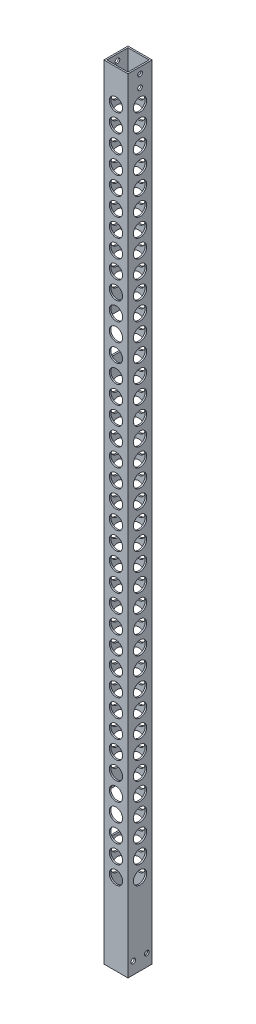
from build123d import *

# Parameters (mm, degrees)
SKETCH1_W                    = 25.4
SKETCH1_H                    = 25.4
SKETCH1_W_2                  = 22.225
SKETCH1_H_2                  = 22.225
BOSS_EXTRUDE1_DEPTH          = 412.3055
CUT_EXTRUDE1_DEPTH           = 413.69650511
CUT_EXTRUDE1_DEPTH_BACK      = 413.69650511
SKETCH2_R                    = 2.4765
CUT_EXTRUDE2_DEPTH           = 413.69650511
CUT_EXTRUDE2_DEPTH_BACK      = 413.69650511
SKETCH3_R                    = 2.4765
CUT_EXTRUDE3_REACH           = 415.282
SKETCH4_W                    = 15.24
SKETCH4_H                    = 15.24
FILLET1_R                    = 2.54
CUT_EXTRUDE4_DEPTH           = 413.69650511
CUT_EXTRUDE4_DEPTH_BACK      = 413.69650511
SKETCH5_R                    = 2.4892
SKETCH6_R                    = 6.985
CUT_EXTRUDE5_DEPTH           = 2.54
LPATTERN1_COUNT              = 38
LPATTERN1_PITCH              = 19.05
CIRPATTERN1_COUNT            = 4
CIRPATTERN1_COPY_1_SKETCH_R  = 6.985
CIRPATTERN1_COPY_1_DEPTH     = 2.54
CIRPATTERN1_COPY_2_SKETCH_R  = 6.985
CIRPATTERN1_COPY_2_DEPTH     = 2.54
CIRPATTERN1_COPY_3_SKETCH_R  = 6.985
CIRPATTERN1_COPY_3_DEPTH     = 2.54
CIRPATTERN1_COPY_4_SKETCH_R  = 6.985
CIRPATTERN1_COPY_4_DEPTH     = 2.54
CIRPATTERN1_COPY_5_SKETCH_R  = 6.985
CIRPATTERN1_COPY_5_DEPTH     = 2.54
CIRPATTERN1_COPY_6_SKETCH_R  = 6.985
CIRPATTERN1_COPY_6_DEPTH     = 2.54
CIRPATTERN1_COPY_7_SKETCH_R  = 6.985
CIRPATTERN1_COPY_7_DEPTH     = 2.54
CIRPATTERN1_COPY_8_SKETCH_R  = 6.985
CIRPATTERN1_COPY_8_DEPTH     = 2.54
CIRPATTERN1_COPY_9_SKETCH_R  = 6.985
CIRPATTERN1_COPY_9_DEPTH     = 2.54
CIRPATTERN1_COPY_10_SKETCH_R = 6.985
CIRPATTERN1_COPY_10_DEPTH    = 2.54
CIRPATTERN1_COPY_11_SKETCH_R = 6.985
CIRPATTERN1_COPY_11_DEPTH    = 2.54
CIRPATTERN1_COPY_12_SKETCH_R = 6.985
CIRPATTERN1_COPY_12_DEPTH    = 2.54
CIRPATTERN1_COPY_13_SKETCH_R = 6.985
CIRPATTERN1_COPY_13_DEPTH    = 2.54
CIRPATTERN1_COPY_14_SKETCH_R = 6.985
CIRPATTERN1_COPY_14_DEPTH    = 2.54
CIRPATTERN1_COPY_15_SKETCH_R = 6.985
CIRPATTERN1_COPY_15_DEPTH    = 2.54
CIRPATTERN1_COPY_16_SKETCH_R = 6.985
CIRPATTERN1_COPY_16_DEPTH    = 2.54
CIRPATTERN1_COPY_17_SKETCH_R = 6.985
CIRPATTERN1_COPY_17_DEPTH    = 2.54
CIRPATTERN1_COPY_18_SKETCH_R = 6.985
CIRPATTERN1_COPY_18_DEPTH    = 2.54
CIRPATTERN1_COPY_19_SKETCH_R = 6.985
CIRPATTERN1_COPY_19_DEPTH    = 2.54
CIRPATTERN1_COPY_20_SKETCH_R = 6.985
CIRPATTERN1_COPY_20_DEPTH    = 2.54
CIRPATTERN1_COPY_21_SKETCH_R = 6.985
CIRPATTERN1_COPY_21_DEPTH    = 2.54
CIRPATTERN1_COPY_22_SKETCH_R = 6.985
CIRPATTERN1_COPY_22_DEPTH    = 2.54
CIRPATTERN1_COPY_23_SKETCH_R = 6.985
CIRPATTERN1_COPY_23_DEPTH    = 2.54
CIRPATTERN1_COPY_24_SKETCH_R = 6.985
CIRPATTERN1_COPY_24_DEPTH    = 2.54
CIRPATTERN1_COPY_25_SKETCH_R = 6.985
CIRPATTERN1_COPY_25_DEPTH    = 2.54
CIRPATTERN1_COPY_26_SKETCH_R = 6.985
CIRPATTERN1_COPY_26_DEPTH    = 2.54
CIRPATTERN1_COPY_27_SKETCH_R = 6.985
CIRPATTERN1_COPY_27_DEPTH    = 2.54
CIRPATTERN1_COPY_28_SKETCH_R = 6.985
CIRPATTERN1_COPY_28_DEPTH    = 2.54
CIRPATTERN1_COPY_29_SKETCH_R = 6.985
CIRPATTERN1_COPY_29_DEPTH    = 2.54
CIRPATTERN1_COPY_30_SKETCH_R = 6.985
CIRPATTERN1_COPY_30_DEPTH    = 2.54
CIRPATTERN1_COPY_31_SKETCH_R = 6.985
CIRPATTERN1_COPY_31_DEPTH    = 2.54
CIRPATTERN1_COPY_32_SKETCH_R = 6.985
CIRPATTERN1_COPY_32_DEPTH    = 2.54
CIRPATTERN1_COPY_33_SKETCH_R = 6.985
CIRPATTERN1_COPY_33_DEPTH    = 2.54
CIRPATTERN1_COPY_34_SKETCH_R = 6.985
CIRPATTERN1_COPY_34_DEPTH    = 2.54
CIRPATTERN1_COPY_35_SKETCH_R = 6.985
CIRPATTERN1_COPY_35_DEPTH    = 2.54
CIRPATTERN1_COPY_36_SKETCH_R = 6.985
CIRPATTERN1_COPY_36_DEPTH    = 2.54
CIRPATTERN1_COPY_37_SKETCH_R = 6.985
CIRPATTERN1_COPY_37_DEPTH    = 2.54
CIRPATTERN1_COPY_38_SKETCH_R = 6.985
CIRPATTERN1_COPY_38_DEPTH    = 2.54
CIRPATTERN1_COPY_39_SKETCH_R = 6.985
CIRPATTERN1_COPY_39_DEPTH    = 2.54
CIRPATTERN1_COPY_40_SKETCH_R = 6.985
CIRPATTERN1_COPY_40_DEPTH    = 2.54
CIRPATTERN1_COPY_41_SKETCH_R = 6.985
CIRPATTERN1_COPY_41_DEPTH    = 2.54
CIRPATTERN1_COPY_42_SKETCH_R = 6.985
CIRPATTERN1_COPY_42_DEPTH    = 2.54
CIRPATTERN1_COPY_43_SKETCH_R = 6.985
CIRPATTERN1_COPY_43_DEPTH    = 2.54
CIRPATTERN1_COPY_44_SKETCH_R = 6.985
CIRPATTERN1_COPY_44_DEPTH    = 2.54
CIRPATTERN1_COPY_45_SKETCH_R = 6.985
CIRPATTERN1_COPY_45_DEPTH    = 2.54
CIRPATTERN1_COPY_46_SKETCH_R = 6.985
CIRPATTERN1_COPY_46_DEPTH    = 2.54
CIRPATTERN1_COPY_47_SKETCH_R = 6.985
CIRPATTERN1_COPY_47_DEPTH    = 2.54
CIRPATTERN1_COPY_48_SKETCH_R = 6.985
CIRPATTERN1_COPY_48_DEPTH    = 2.54
CIRPATTERN1_COPY_49_SKETCH_R = 6.985
CIRPATTERN1_COPY_49_DEPTH    = 2.54
CIRPATTERN1_COPY_50_SKETCH_R = 6.985
CIRPATTERN1_COPY_50_DEPTH    = 2.54
CIRPATTERN1_COPY_51_SKETCH_R = 6.985
CIRPATTERN1_COPY_51_DEPTH    = 2.54
CIRPATTERN1_COPY_52_SKETCH_R = 6.985
CIRPATTERN1_COPY_52_DEPTH    = 2.54
CIRPATTERN1_COPY_53_SKETCH_R = 6.985
CIRPATTERN1_COPY_53_DEPTH    = 2.54
CIRPATTERN1_COPY_54_SKETCH_R = 6.985
CIRPATTERN1_COPY_54_DEPTH    = 2.54
CIRPATTERN1_COPY_55_SKETCH_R = 6.985
CIRPATTERN1_COPY_55_DEPTH    = 2.54
CIRPATTERN1_COPY_56_SKETCH_R = 6.985
CIRPATTERN1_COPY_56_DEPTH    = 2.54
CIRPATTERN1_COPY_57_SKETCH_R = 6.985
CIRPATTERN1_COPY_57_DEPTH    = 2.54
CIRPATTERN1_COPY_58_SKETCH_R = 6.985
CIRPATTERN1_COPY_58_DEPTH    = 2.54
CIRPATTERN1_COPY_59_SKETCH_R = 6.985
CIRPATTERN1_COPY_59_DEPTH    = 2.54
CIRPATTERN1_COPY_60_SKETCH_R = 6.985
CIRPATTERN1_COPY_60_DEPTH    = 2.54
CIRPATTERN1_COPY_61_SKETCH_R = 6.985
CIRPATTERN1_COPY_61_DEPTH    = 2.54
CIRPATTERN1_COPY_62_SKETCH_R = 6.985
CIRPATTERN1_COPY_62_DEPTH    = 2.54
CIRPATTERN1_COPY_63_SKETCH_R = 6.985
CIRPATTERN1_COPY_63_DEPTH    = 2.54
CIRPATTERN1_COPY_64_SKETCH_R = 6.985
CIRPATTERN1_COPY_64_DEPTH    = 2.54
CIRPATTERN1_COPY_65_SKETCH_R = 6.985
CIRPATTERN1_COPY_65_DEPTH    = 2.54
CIRPATTERN1_COPY_66_SKETCH_R = 6.985
CIRPATTERN1_COPY_66_DEPTH    = 2.54
CIRPATTERN1_COPY_67_SKETCH_R = 6.985
CIRPATTERN1_COPY_67_DEPTH    = 2.54
CIRPATTERN1_COPY_68_SKETCH_R = 6.985
CIRPATTERN1_COPY_68_DEPTH    = 2.54
CIRPATTERN1_COPY_69_SKETCH_R = 6.985
CIRPATTERN1_COPY_69_DEPTH    = 2.54
CIRPATTERN1_COPY_70_SKETCH_R = 6.985
CIRPATTERN1_COPY_70_DEPTH    = 2.54
CIRPATTERN1_COPY_71_SKETCH_R = 6.985
CIRPATTERN1_COPY_71_DEPTH    = 2.54
CIRPATTERN1_COPY_72_SKETCH_R = 6.985
CIRPATTERN1_COPY_72_DEPTH    = 2.54
CIRPATTERN1_COPY_73_SKETCH_R = 6.985
CIRPATTERN1_COPY_73_DEPTH    = 2.54
CIRPATTERN1_COPY_74_SKETCH_R = 6.985
CIRPATTERN1_COPY_74_DEPTH    = 2.54
SKETCH7_W                    = 19.05
SKETCH7_H                    = 38.1
CUT_EXTRUDE6_DEPTH           = 2.54
CUT_EXTRUDE7_START           = -2.54
SKETCH8_R                    = 6.985
CUT_EXTRUDE7_DEPTH           = 2.54
LPATTERN2_COUNT              = 38
LPATTERN2_PITCH              = 19.05


with BuildPart() as part:
    # Sketch1 → Boss-Extrude1 (new, symmetric)
    with BuildSketch(Plane(origin=(0, 0, 0), x_dir=(1, 0, 0), z_dir=(0, 1, 0))):
        Rectangle(SKETCH1_W, SKETCH1_H)
        Rectangle(SKETCH1_W_2, SKETCH1_H_2, mode=Mode.SUBTRACT)
    extrude(amount=BOSS_EXTRUDE1_DEPTH, both=True)

    # Sketch2 → Cut-Extrude1 (cut, two sides: drawn at the far end of the back side and taken through both)
    with BuildSketch(Plane(origin=(0, 0, 0), x_dir=(0, 0, -1), z_dir=(1, 0, 0)).offset(-CUT_EXTRUDE1_DEPTH_BACK)):
        with Locations((-7.14375, -399.6055)):
            Circle(SKETCH2_R)
        with Locations((7.14375, -399.6055)):
            Circle(SKETCH2_R)
    extrude(amount=CUT_EXTRUDE1_DEPTH + CUT_EXTRUDE1_DEPTH_BACK, mode=Mode.SUBTRACT)

    # Sketch3 → Cut-Extrude2 (cut, two sides: drawn at the far end of the back side and taken through both)
    with BuildSketch(Plane(origin=(0, 0, 0), x_dir=(0, 0, -1), z_dir=(1, 0, 0)).offset(-CUT_EXTRUDE2_DEPTH_BACK)):
        with Locations((0, 405.9555)):
            Circle(SKETCH3_R)
        with Locations((0, 393.2555)):
            Circle(SKETCH3_R)
    extrude(amount=CUT_EXTRUDE2_DEPTH + CUT_EXTRUDE2_DEPTH_BACK, mode=Mode.SUBTRACT)

    # Sketch4 → Cut-Extrude3 (cut, up to next)
    with BuildSketch(Plane.ZY.offset(12.7), mode=Mode.PRIVATE) as cut_extrude3_sk1:
        with Locations((0, -290.5125)):
            Rectangle(SKETCH4_W, SKETCH4_H)
    cut_extrude3_tool1 = extrude(cut_extrude3_sk1.sketch, amount=-CUT_EXTRUDE3_REACH, mode=Mode.PRIVATE) & part.part
    add(cut_extrude3_tool1.solids().sort_by_distance((-12.7, -290.5125, 0))[0], mode=Mode.SUBTRACT)

    # Fillet1
    fillet1_edges = [part.edges().sort_by_distance(p)[0] for p in [
        (-11.90625, -282.8925, -7.62),
        (-11.90625, -298.1325, -7.62),
        (-11.90625, -298.1325, 7.62),
        (-11.90625, -282.8925, 7.62),
    ]]
    fillet(fillet1_edges, radius=FILLET1_R)

    # Sketch5 → Cut-Extrude4 (cut, two sides: drawn at the far end of the back side and taken through both)
    with BuildSketch(Plane.XY.offset(-CUT_EXTRUDE4_DEPTH_BACK)):
        with Locations((0, 380.5555)):
            Circle(SKETCH5_R)
        with Locations((0, 361.5055)):
            Circle(SKETCH5_R)
        with Locations((0, 342.4555)):
            Circle(SKETCH5_R)
        with Locations((0, 323.4055)):
            Circle(SKETCH5_R)
        with Locations((0, 304.3555)):
            Circle(SKETCH5_R)
        with Locations((0, 285.3055)):
            Circle(SKETCH5_R)
        with Locations((0, 266.2555)):
            Circle(SKETCH5_R)
        with Locations((0, 247.2055)):
            Circle(SKETCH5_R)
        with Locations((0, 228.1555)):
            Circle(SKETCH5_R)
        with Locations((0, 209.1055)):
            Circle(SKETCH5_R)
        with Locations((0, 190.0555)):
            Circle(SKETCH5_R)
        with Locations((0, 171.0055)):
            Circle(SKETCH5_R)
        with Locations((0, 151.9555)):
            Circle(SKETCH5_R)
        with Locations((0, 132.9055)):
            Circle(SKETCH5_R)
        with Locations((0, 113.8555)):
            Circle(SKETCH5_R)
    extrude(amount=CUT_EXTRUDE4_DEPTH + CUT_EXTRUDE4_DEPTH_BACK, mode=Mode.SUBTRACT)

    # Sketch6 → Cut-Extrude5 (cut)
    with BuildSketch(Plane.XY.offset(12.7)):
        with Locations((0, 378.0155)):
            Circle(SKETCH6_R)
    cut_extrude5 = extrude(amount=-CUT_EXTRUDE5_DEPTH, mode=Mode.SUBTRACT)

    # LPattern1: Cut-Extrude5 ×38
    with Locations(*[(0, -i * LPATTERN1_PITCH, 0) for i in range(1, LPATTERN1_COUNT)]):
        add(cut_extrude5, mode=Mode.SUBTRACT)

    # CirPattern1: Cut-Extrude5 ×4 about axis, 1 skipped
    cirpattern1_axis = Axis((0, -453.53605, 0), (0, 1, 0))
    add([cut_extrude5.rotate(cirpattern1_axis, i * 360 / CIRPATTERN1_COUNT) for i in range(1, CIRPATTERN1_COUNT) if i not in (3,)], mode=Mode.SUBTRACT)

    # CirPattern1 copy 1 sketch → CirPattern1 copy 1 (cut)
    with BuildSketch(Plane(origin=(12.7, -19.05, 0), x_dir=(0, 0, -1), z_dir=(1, 0, 0))):
        with Locations((0, 378.0155)):
            Circle(CIRPATTERN1_COPY_1_SKETCH_R)
    extrude(amount=-CIRPATTERN1_COPY_1_DEPTH, mode=Mode.SUBTRACT)

    # CirPattern1 copy 2 sketch → CirPattern1 copy 2 (cut)
    with BuildSketch(Plane(origin=(0, -19.05, -12.7), x_dir=(-1, 0, 0), z_dir=(0, 0, -1))):
        with Locations((0, 378.0155)):
            Circle(CIRPATTERN1_COPY_2_SKETCH_R)
    extrude(amount=-CIRPATTERN1_COPY_2_DEPTH, mode=Mode.SUBTRACT)

    # CirPattern1 copy 3 sketch → CirPattern1 copy 3 (cut)
    with BuildSketch(Plane(origin=(12.7, -38.1, 0), x_dir=(0, 0, -1), z_dir=(1, 0, 0))):
        with Locations((0, 378.0155)):
            Circle(CIRPATTERN1_COPY_3_SKETCH_R)
    extrude(amount=-CIRPATTERN1_COPY_3_DEPTH, mode=Mode.SUBTRACT)

    # CirPattern1 copy 4 sketch → CirPattern1 copy 4 (cut)
    with BuildSketch(Plane(origin=(0, -38.1, -12.7), x_dir=(-1, 0, 0), z_dir=(0, 0, -1))):
        with Locations((0, 378.0155)):
            Circle(CIRPATTERN1_COPY_4_SKETCH_R)
    extrude(amount=-CIRPATTERN1_COPY_4_DEPTH, mode=Mode.SUBTRACT)

    # CirPattern1 copy 5 sketch → CirPattern1 copy 5 (cut)
    with BuildSketch(Plane(origin=(12.7, -57.15, 0), x_dir=(0, 0, -1), z_dir=(1, 0, 0))):
        with Locations((0, 378.0155)):
            Circle(CIRPATTERN1_COPY_5_SKETCH_R)
    extrude(amount=-CIRPATTERN1_COPY_5_DEPTH, mode=Mode.SUBTRACT)

    # CirPattern1 copy 6 sketch → CirPattern1 copy 6 (cut)
    with BuildSketch(Plane(origin=(0, -57.15, -12.7), x_dir=(-1, 0, 0), z_dir=(0, 0, -1))):
        with Locations((0, 378.0155)):
            Circle(CIRPATTERN1_COPY_6_SKETCH_R)
    extrude(amount=-CIRPATTERN1_COPY_6_DEPTH, mode=Mode.SUBTRACT)

    # CirPattern1 copy 7 sketch → CirPattern1 copy 7 (cut)
    with BuildSketch(Plane(origin=(12.7, -76.2, 0), x_dir=(0, 0, -1), z_dir=(1, 0, 0))):
        with Locations((0, 378.0155)):
            Circle(CIRPATTERN1_COPY_7_SKETCH_R)
    extrude(amount=-CIRPATTERN1_COPY_7_DEPTH, mode=Mode.SUBTRACT)

    # CirPattern1 copy 8 sketch → CirPattern1 copy 8 (cut)
    with BuildSketch(Plane(origin=(0, -76.2, -12.7), x_dir=(-1, 0, 0), z_dir=(0, 0, -1))):
        with Locations((0, 378.0155)):
            Circle(CIRPATTERN1_COPY_8_SKETCH_R)
    extrude(amount=-CIRPATTERN1_COPY_8_DEPTH, mode=Mode.SUBTRACT)

    # CirPattern1 copy 9 sketch → CirPattern1 copy 9 (cut)
    with BuildSketch(Plane(origin=(12.7, -95.25, 0), x_dir=(0, 0, -1), z_dir=(1, 0, 0))):
        with Locations((0, 378.0155)):
            Circle(CIRPATTERN1_COPY_9_SKETCH_R)
    extrude(amount=-CIRPATTERN1_COPY_9_DEPTH, mode=Mode.SUBTRACT)

    # CirPattern1 copy 10 sketch → CirPattern1 copy 10 (cut)
    with BuildSketch(Plane(origin=(0, -95.25, -12.7), x_dir=(-1, 0, 0), z_dir=(0, 0, -1))):
        with Locations((0, 378.0155)):
            Circle(CIRPATTERN1_COPY_10_SKETCH_R)
    extrude(amount=-CIRPATTERN1_COPY_10_DEPTH, mode=Mode.SUBTRACT)

    # CirPattern1 copy 11 sketch → CirPattern1 copy 11 (cut)
    with BuildSketch(Plane(origin=(12.7, -114.3, 0), x_dir=(0, 0, -1), z_dir=(1, 0, 0))):
        with Locations((0, 378.0155)):
            Circle(CIRPATTERN1_COPY_11_SKETCH_R)
    extrude(amount=-CIRPATTERN1_COPY_11_DEPTH, mode=Mode.SUBTRACT)

    # CirPattern1 copy 12 sketch → CirPattern1 copy 12 (cut)
    with BuildSketch(Plane(origin=(0, -114.3, -12.7), x_dir=(-1, 0, 0), z_dir=(0, 0, -1))):
        with Locations((0, 378.0155)):
            Circle(CIRPATTERN1_COPY_12_SKETCH_R)
    extrude(amount=-CIRPATTERN1_COPY_12_DEPTH, mode=Mode.SUBTRACT)

    # CirPattern1 copy 13 sketch → CirPattern1 copy 13 (cut)
    with BuildSketch(Plane(origin=(12.7, -133.35, 0), x_dir=(0, 0, -1), z_dir=(1, 0, 0))):
        with Locations((0, 378.0155)):
            Circle(CIRPATTERN1_COPY_13_SKETCH_R)
    extrude(amount=-CIRPATTERN1_COPY_13_DEPTH, mode=Mode.SUBTRACT)

    # CirPattern1 copy 14 sketch → CirPattern1 copy 14 (cut)
    with BuildSketch(Plane(origin=(0, -133.35, -12.7), x_dir=(-1, 0, 0), z_dir=(0, 0, -1))):
        with Locations((0, 378.0155)):
            Circle(CIRPATTERN1_COPY_14_SKETCH_R)
    extrude(amount=-CIRPATTERN1_COPY_14_DEPTH, mode=Mode.SUBTRACT)

    # CirPattern1 copy 15 sketch → CirPattern1 copy 15 (cut)
    with BuildSketch(Plane(origin=(12.7, -152.4, 0), x_dir=(0, 0, -1), z_dir=(1, 0, 0))):
        with Locations((0, 378.0155)):
            Circle(CIRPATTERN1_COPY_15_SKETCH_R)
    extrude(amount=-CIRPATTERN1_COPY_15_DEPTH, mode=Mode.SUBTRACT)

    # CirPattern1 copy 16 sketch → CirPattern1 copy 16 (cut)
    with BuildSketch(Plane(origin=(0, -152.4, -12.7), x_dir=(-1, 0, 0), z_dir=(0, 0, -1))):
        with Locations((0, 378.0155)):
            Circle(CIRPATTERN1_COPY_16_SKETCH_R)
    extrude(amount=-CIRPATTERN1_COPY_16_DEPTH, mode=Mode.SUBTRACT)

    # CirPattern1 copy 17 sketch → CirPattern1 copy 17 (cut)
    with BuildSketch(Plane(origin=(12.7, -171.45, 0), x_dir=(0, 0, -1), z_dir=(1, 0, 0))):
        with Locations((0, 378.0155)):
            Circle(CIRPATTERN1_COPY_17_SKETCH_R)
    extrude(amount=-CIRPATTERN1_COPY_17_DEPTH, mode=Mode.SUBTRACT)

    # CirPattern1 copy 18 sketch → CirPattern1 copy 18 (cut)
    with BuildSketch(Plane(origin=(0, -171.45, -12.7), x_dir=(-1, 0, 0), z_dir=(0, 0, -1))):
        with Locations((0, 378.0155)):
            Circle(CIRPATTERN1_COPY_18_SKETCH_R)
    extrude(amount=-CIRPATTERN1_COPY_18_DEPTH, mode=Mode.SUBTRACT)

    # CirPattern1 copy 19 sketch → CirPattern1 copy 19 (cut)
    with BuildSketch(Plane(origin=(12.7, -190.5, 0), x_dir=(0, 0, -1), z_dir=(1, 0, 0))):
        with Locations((0, 378.0155)):
            Circle(CIRPATTERN1_COPY_19_SKETCH_R)
    extrude(amount=-CIRPATTERN1_COPY_19_DEPTH, mode=Mode.SUBTRACT)

    # CirPattern1 copy 20 sketch → CirPattern1 copy 20 (cut)
    with BuildSketch(Plane(origin=(0, -190.5, -12.7), x_dir=(-1, 0, 0), z_dir=(0, 0, -1))):
        with Locations((0, 378.0155)):
            Circle(CIRPATTERN1_COPY_20_SKETCH_R)
    extrude(amount=-CIRPATTERN1_COPY_20_DEPTH, mode=Mode.SUBTRACT)

    # CirPattern1 copy 21 sketch → CirPattern1 copy 21 (cut)
    with BuildSketch(Plane(origin=(12.7, -209.55, 0), x_dir=(0, 0, -1), z_dir=(1, 0, 0))):
        with Locations((0, 378.0155)):
            Circle(CIRPATTERN1_COPY_21_SKETCH_R)
    extrude(amount=-CIRPATTERN1_COPY_21_DEPTH, mode=Mode.SUBTRACT)

    # CirPattern1 copy 22 sketch → CirPattern1 copy 22 (cut)
    with BuildSketch(Plane(origin=(0, -209.55, -12.7), x_dir=(-1, 0, 0), z_dir=(0, 0, -1))):
        with Locations((0, 378.0155)):
            Circle(CIRPATTERN1_COPY_22_SKETCH_R)
    extrude(amount=-CIRPATTERN1_COPY_22_DEPTH, mode=Mode.SUBTRACT)

    # CirPattern1 copy 23 sketch → CirPattern1 copy 23 (cut)
    with BuildSketch(Plane(origin=(12.7, -228.6, 0), x_dir=(0, 0, -1), z_dir=(1, 0, 0))):
        with Locations((0, 378.0155)):
            Circle(CIRPATTERN1_COPY_23_SKETCH_R)
    extrude(amount=-CIRPATTERN1_COPY_23_DEPTH, mode=Mode.SUBTRACT)

    # CirPattern1 copy 24 sketch → CirPattern1 copy 24 (cut)
    with BuildSketch(Plane(origin=(0, -228.6, -12.7), x_dir=(-1, 0, 0), z_dir=(0, 0, -1))):
        with Locations((0, 378.0155)):
            Circle(CIRPATTERN1_COPY_24_SKETCH_R)
    extrude(amount=-CIRPATTERN1_COPY_24_DEPTH, mode=Mode.SUBTRACT)

    # CirPattern1 copy 25 sketch → CirPattern1 copy 25 (cut)
    with BuildSketch(Plane(origin=(12.7, -247.65, 0), x_dir=(0, 0, -1), z_dir=(1, 0, 0))):
        with Locations((0, 378.0155)):
            Circle(CIRPATTERN1_COPY_25_SKETCH_R)
    extrude(amount=-CIRPATTERN1_COPY_25_DEPTH, mode=Mode.SUBTRACT)

    # CirPattern1 copy 26 sketch → CirPattern1 copy 26 (cut)
    with BuildSketch(Plane(origin=(0, -247.65, -12.7), x_dir=(-1, 0, 0), z_dir=(0, 0, -1))):
        with Locations((0, 378.0155)):
            Circle(CIRPATTERN1_COPY_26_SKETCH_R)
    extrude(amount=-CIRPATTERN1_COPY_26_DEPTH, mode=Mode.SUBTRACT)

    # CirPattern1 copy 27 sketch → CirPattern1 copy 27 (cut)
    with BuildSketch(Plane(origin=(12.7, -266.7, 0), x_dir=(0, 0, -1), z_dir=(1, 0, 0))):
        with Locations((0, 378.0155)):
            Circle(CIRPATTERN1_COPY_27_SKETCH_R)
    extrude(amount=-CIRPATTERN1_COPY_27_DEPTH, mode=Mode.SUBTRACT)

    # CirPattern1 copy 28 sketch → CirPattern1 copy 28 (cut)
    with BuildSketch(Plane(origin=(0, -266.7, -12.7), x_dir=(-1, 0, 0), z_dir=(0, 0, -1))):
        with Locations((0, 378.0155)):
            Circle(CIRPATTERN1_COPY_28_SKETCH_R)
    extrude(amount=-CIRPATTERN1_COPY_28_DEPTH, mode=Mode.SUBTRACT)

    # CirPattern1 copy 29 sketch → CirPattern1 copy 29 (cut)
    with BuildSketch(Plane(origin=(12.7, -285.75, 0), x_dir=(0, 0, -1), z_dir=(1, 0, 0))):
        with Locations((0, 378.0155)):
            Circle(CIRPATTERN1_COPY_29_SKETCH_R)
    extrude(amount=-CIRPATTERN1_COPY_29_DEPTH, mode=Mode.SUBTRACT)

    # CirPattern1 copy 30 sketch → CirPattern1 copy 30 (cut)
    with BuildSketch(Plane(origin=(0, -285.75, -12.7), x_dir=(-1, 0, 0), z_dir=(0, 0, -1))):
        with Locations((0, 378.0155)):
            Circle(CIRPATTERN1_COPY_30_SKETCH_R)
    extrude(amount=-CIRPATTERN1_COPY_30_DEPTH, mode=Mode.SUBTRACT)

    # CirPattern1 copy 31 sketch → CirPattern1 copy 31 (cut)
    with BuildSketch(Plane(origin=(12.7, -304.8, 0), x_dir=(0, 0, -1), z_dir=(1, 0, 0))):
        with Locations((0, 378.0155)):
            Circle(CIRPATTERN1_COPY_31_SKETCH_R)
    extrude(amount=-CIRPATTERN1_COPY_31_DEPTH, mode=Mode.SUBTRACT)

    # CirPattern1 copy 32 sketch → CirPattern1 copy 32 (cut)
    with BuildSketch(Plane(origin=(0, -304.8, -12.7), x_dir=(-1, 0, 0), z_dir=(0, 0, -1))):
        with Locations((0, 378.0155)):
            Circle(CIRPATTERN1_COPY_32_SKETCH_R)
    extrude(amount=-CIRPATTERN1_COPY_32_DEPTH, mode=Mode.SUBTRACT)

    # CirPattern1 copy 33 sketch → CirPattern1 copy 33 (cut)
    with BuildSketch(Plane(origin=(12.7, -323.85, 0), x_dir=(0, 0, -1), z_dir=(1, 0, 0))):
        with Locations((0, 378.0155)):
            Circle(CIRPATTERN1_COPY_33_SKETCH_R)
    extrude(amount=-CIRPATTERN1_COPY_33_DEPTH, mode=Mode.SUBTRACT)

    # CirPattern1 copy 34 sketch → CirPattern1 copy 34 (cut)
    with BuildSketch(Plane(origin=(0, -323.85, -12.7), x_dir=(-1, 0, 0), z_dir=(0, 0, -1))):
        with Locations((0, 378.0155)):
            Circle(CIRPATTERN1_COPY_34_SKETCH_R)
    extrude(amount=-CIRPATTERN1_COPY_34_DEPTH, mode=Mode.SUBTRACT)

    # CirPattern1 copy 35 sketch → CirPattern1 copy 35 (cut)
    with BuildSketch(Plane(origin=(12.7, -342.9, 0), x_dir=(0, 0, -1), z_dir=(1, 0, 0))):
        with Locations((0, 378.0155)):
            Circle(CIRPATTERN1_COPY_35_SKETCH_R)
    extrude(amount=-CIRPATTERN1_COPY_35_DEPTH, mode=Mode.SUBTRACT)

    # CirPattern1 copy 36 sketch → CirPattern1 copy 36 (cut)
    with BuildSketch(Plane(origin=(0, -342.9, -12.7), x_dir=(-1, 0, 0), z_dir=(0, 0, -1))):
        with Locations((0, 378.0155)):
            Circle(CIRPATTERN1_COPY_36_SKETCH_R)
    extrude(amount=-CIRPATTERN1_COPY_36_DEPTH, mode=Mode.SUBTRACT)

    # CirPattern1 copy 37 sketch → CirPattern1 copy 37 (cut)
    with BuildSketch(Plane(origin=(12.7, -361.95, 0), x_dir=(0, 0, -1), z_dir=(1, 0, 0))):
        with Locations((0, 378.0155)):
            Circle(CIRPATTERN1_COPY_37_SKETCH_R)
    extrude(amount=-CIRPATTERN1_COPY_37_DEPTH, mode=Mode.SUBTRACT)

    # CirPattern1 copy 38 sketch → CirPattern1 copy 38 (cut)
    with BuildSketch(Plane(origin=(0, -361.95, -12.7), x_dir=(-1, 0, 0), z_dir=(0, 0, -1))):
        with Locations((0, 378.0155)):
            Circle(CIRPATTERN1_COPY_38_SKETCH_R)
    extrude(amount=-CIRPATTERN1_COPY_38_DEPTH, mode=Mode.SUBTRACT)

    # CirPattern1 copy 39 sketch → CirPattern1 copy 39 (cut)
    with BuildSketch(Plane(origin=(12.7, -381, 0), x_dir=(0, 0, -1), z_dir=(1, 0, 0))):
        with Locations((0, 378.0155)):
            Circle(CIRPATTERN1_COPY_39_SKETCH_R)
    extrude(amount=-CIRPATTERN1_COPY_39_DEPTH, mode=Mode.SUBTRACT)

    # CirPattern1 copy 40 sketch → CirPattern1 copy 40 (cut)
    with BuildSketch(Plane(origin=(0, -381, -12.7), x_dir=(-1, 0, 0), z_dir=(0, 0, -1))):
        with Locations((0, 378.0155)):
            Circle(CIRPATTERN1_COPY_40_SKETCH_R)
    extrude(amount=-CIRPATTERN1_COPY_40_DEPTH, mode=Mode.SUBTRACT)

    # CirPattern1 copy 41 sketch → CirPattern1 copy 41 (cut)
    with BuildSketch(Plane(origin=(12.7, -400.05, 0), x_dir=(0, 0, -1), z_dir=(1, 0, 0))):
        with Locations((0, 378.0155)):
            Circle(CIRPATTERN1_COPY_41_SKETCH_R)
    extrude(amount=-CIRPATTERN1_COPY_41_DEPTH, mode=Mode.SUBTRACT)

    # CirPattern1 copy 42 sketch → CirPattern1 copy 42 (cut)
    with BuildSketch(Plane(origin=(0, -400.05, -12.7), x_dir=(-1, 0, 0), z_dir=(0, 0, -1))):
        with Locations((0, 378.0155)):
            Circle(CIRPATTERN1_COPY_42_SKETCH_R)
    extrude(amount=-CIRPATTERN1_COPY_42_DEPTH, mode=Mode.SUBTRACT)

    # CirPattern1 copy 43 sketch → CirPattern1 copy 43 (cut)
    with BuildSketch(Plane(origin=(12.7, -419.1, 0), x_dir=(0, 0, -1), z_dir=(1, 0, 0))):
        with Locations((0, 378.0155)):
            Circle(CIRPATTERN1_COPY_43_SKETCH_R)
    extrude(amount=-CIRPATTERN1_COPY_43_DEPTH, mode=Mode.SUBTRACT)

    # CirPattern1 copy 44 sketch → CirPattern1 copy 44 (cut)
    with BuildSketch(Plane(origin=(0, -419.1, -12.7), x_dir=(-1, 0, 0), z_dir=(0, 0, -1))):
        with Locations((0, 378.0155)):
            Circle(CIRPATTERN1_COPY_44_SKETCH_R)
    extrude(amount=-CIRPATTERN1_COPY_44_DEPTH, mode=Mode.SUBTRACT)

    # CirPattern1 copy 45 sketch → CirPattern1 copy 45 (cut)
    with BuildSketch(Plane(origin=(12.7, -438.15, 0), x_dir=(0, 0, -1), z_dir=(1, 0, 0))):
        with Locations((0, 378.0155)):
            Circle(CIRPATTERN1_COPY_45_SKETCH_R)
    extrude(amount=-CIRPATTERN1_COPY_45_DEPTH, mode=Mode.SUBTRACT)

    # CirPattern1 copy 46 sketch → CirPattern1 copy 46 (cut)
    with BuildSketch(Plane(origin=(0, -438.15, -12.7), x_dir=(-1, 0, 0), z_dir=(0, 0, -1))):
        with Locations((0, 378.0155)):
            Circle(CIRPATTERN1_COPY_46_SKETCH_R)
    extrude(amount=-CIRPATTERN1_COPY_46_DEPTH, mode=Mode.SUBTRACT)

    # CirPattern1 copy 47 sketch → CirPattern1 copy 47 (cut)
    with BuildSketch(Plane(origin=(12.7, -457.2, 0), x_dir=(0, 0, -1), z_dir=(1, 0, 0))):
        with Locations((0, 378.0155)):
            Circle(CIRPATTERN1_COPY_47_SKETCH_R)
    extrude(amount=-CIRPATTERN1_COPY_47_DEPTH, mode=Mode.SUBTRACT)

    # CirPattern1 copy 48 sketch → CirPattern1 copy 48 (cut)
    with BuildSketch(Plane(origin=(0, -457.2, -12.7), x_dir=(-1, 0, 0), z_dir=(0, 0, -1))):
        with Locations((0, 378.0155)):
            Circle(CIRPATTERN1_COPY_48_SKETCH_R)
    extrude(amount=-CIRPATTERN1_COPY_48_DEPTH, mode=Mode.SUBTRACT)

    # CirPattern1 copy 49 sketch → CirPattern1 copy 49 (cut)
    with BuildSketch(Plane(origin=(12.7, -476.25, 0), x_dir=(0, 0, -1), z_dir=(1, 0, 0))):
        with Locations((0, 378.0155)):
            Circle(CIRPATTERN1_COPY_49_SKETCH_R)
    extrude(amount=-CIRPATTERN1_COPY_49_DEPTH, mode=Mode.SUBTRACT)

    # CirPattern1 copy 50 sketch → CirPattern1 copy 50 (cut)
    with BuildSketch(Plane(origin=(0, -476.25, -12.7), x_dir=(-1, 0, 0), z_dir=(0, 0, -1))):
        with Locations((0, 378.0155)):
            Circle(CIRPATTERN1_COPY_50_SKETCH_R)
    extrude(amount=-CIRPATTERN1_COPY_50_DEPTH, mode=Mode.SUBTRACT)

    # CirPattern1 copy 51 sketch → CirPattern1 copy 51 (cut)
    with BuildSketch(Plane(origin=(12.7, -495.3, 0), x_dir=(0, 0, -1), z_dir=(1, 0, 0))):
        with Locations((0, 378.0155)):
            Circle(CIRPATTERN1_COPY_51_SKETCH_R)
    extrude(amount=-CIRPATTERN1_COPY_51_DEPTH, mode=Mode.SUBTRACT)

    # CirPattern1 copy 52 sketch → CirPattern1 copy 52 (cut)
    with BuildSketch(Plane(origin=(0, -495.3, -12.7), x_dir=(-1, 0, 0), z_dir=(0, 0, -1))):
        with Locations((0, 378.0155)):
            Circle(CIRPATTERN1_COPY_52_SKETCH_R)
    extrude(amount=-CIRPATTERN1_COPY_52_DEPTH, mode=Mode.SUBTRACT)

    # CirPattern1 copy 53 sketch → CirPattern1 copy 53 (cut)
    with BuildSketch(Plane(origin=(12.7, -514.35, 0), x_dir=(0, 0, -1), z_dir=(1, 0, 0))):
        with Locations((0, 378.0155)):
            Circle(CIRPATTERN1_COPY_53_SKETCH_R)
    extrude(amount=-CIRPATTERN1_COPY_53_DEPTH, mode=Mode.SUBTRACT)

    # CirPattern1 copy 54 sketch → CirPattern1 copy 54 (cut)
    with BuildSketch(Plane(origin=(0, -514.35, -12.7), x_dir=(-1, 0, 0), z_dir=(0, 0, -1))):
        with Locations((0, 378.0155)):
            Circle(CIRPATTERN1_COPY_54_SKETCH_R)
    extrude(amount=-CIRPATTERN1_COPY_54_DEPTH, mode=Mode.SUBTRACT)

    # CirPattern1 copy 55 sketch → CirPattern1 copy 55 (cut)
    with BuildSketch(Plane(origin=(12.7, -533.4, 0), x_dir=(0, 0, -1), z_dir=(1, 0, 0))):
        with Locations((0, 378.0155)):
            Circle(CIRPATTERN1_COPY_55_SKETCH_R)
    extrude(amount=-CIRPATTERN1_COPY_55_DEPTH, mode=Mode.SUBTRACT)

    # CirPattern1 copy 56 sketch → CirPattern1 copy 56 (cut)
    with BuildSketch(Plane(origin=(0, -533.4, -12.7), x_dir=(-1, 0, 0), z_dir=(0, 0, -1))):
        with Locations((0, 378.0155)):
            Circle(CIRPATTERN1_COPY_56_SKETCH_R)
    extrude(amount=-CIRPATTERN1_COPY_56_DEPTH, mode=Mode.SUBTRACT)

    # CirPattern1 copy 57 sketch → CirPattern1 copy 57 (cut)
    with BuildSketch(Plane(origin=(12.7, -552.45, 0), x_dir=(0, 0, -1), z_dir=(1, 0, 0))):
        with Locations((0, 378.0155)):
            Circle(CIRPATTERN1_COPY_57_SKETCH_R)
    extrude(amount=-CIRPATTERN1_COPY_57_DEPTH, mode=Mode.SUBTRACT)

    # CirPattern1 copy 58 sketch → CirPattern1 copy 58 (cut)
    with BuildSketch(Plane(origin=(0, -552.45, -12.7), x_dir=(-1, 0, 0), z_dir=(0, 0, -1))):
        with Locations((0, 378.0155)):
            Circle(CIRPATTERN1_COPY_58_SKETCH_R)
    extrude(amount=-CIRPATTERN1_COPY_58_DEPTH, mode=Mode.SUBTRACT)

    # CirPattern1 copy 59 sketch → CirPattern1 copy 59 (cut)
    with BuildSketch(Plane(origin=(12.7, -571.5, 0), x_dir=(0, 0, -1), z_dir=(1, 0, 0))):
        with Locations((0, 378.0155)):
            Circle(CIRPATTERN1_COPY_59_SKETCH_R)
    extrude(amount=-CIRPATTERN1_COPY_59_DEPTH, mode=Mode.SUBTRACT)

    # CirPattern1 copy 60 sketch → CirPattern1 copy 60 (cut)
    with BuildSketch(Plane(origin=(0, -571.5, -12.7), x_dir=(-1, 0, 0), z_dir=(0, 0, -1))):
        with Locations((0, 378.0155)):
            Circle(CIRPATTERN1_COPY_60_SKETCH_R)
    extrude(amount=-CIRPATTERN1_COPY_60_DEPTH, mode=Mode.SUBTRACT)

    # CirPattern1 copy 61 sketch → CirPattern1 copy 61 (cut)
    with BuildSketch(Plane(origin=(12.7, -590.55, 0), x_dir=(0, 0, -1), z_dir=(1, 0, 0))):
        with Locations((0, 378.0155)):
            Circle(CIRPATTERN1_COPY_61_SKETCH_R)
    extrude(amount=-CIRPATTERN1_COPY_61_DEPTH, mode=Mode.SUBTRACT)

    # CirPattern1 copy 62 sketch → CirPattern1 copy 62 (cut)
    with BuildSketch(Plane(origin=(0, -590.55, -12.7), x_dir=(-1, 0, 0), z_dir=(0, 0, -1))):
        with Locations((0, 378.0155)):
            Circle(CIRPATTERN1_COPY_62_SKETCH_R)
    extrude(amount=-CIRPATTERN1_COPY_62_DEPTH, mode=Mode.SUBTRACT)

    # CirPattern1 copy 63 sketch → CirPattern1 copy 63 (cut)
    with BuildSketch(Plane(origin=(12.7, -609.6, 0), x_dir=(0, 0, -1), z_dir=(1, 0, 0))):
        with Locations((0, 378.0155)):
            Circle(CIRPATTERN1_COPY_63_SKETCH_R)
    extrude(amount=-CIRPATTERN1_COPY_63_DEPTH, mode=Mode.SUBTRACT)

    # CirPattern1 copy 64 sketch → CirPattern1 copy 64 (cut)
    with BuildSketch(Plane(origin=(0, -609.6, -12.7), x_dir=(-1, 0, 0), z_dir=(0, 0, -1))):
        with Locations((0, 378.0155)):
            Circle(CIRPATTERN1_COPY_64_SKETCH_R)
    extrude(amount=-CIRPATTERN1_COPY_64_DEPTH, mode=Mode.SUBTRACT)

    # CirPattern1 copy 65 sketch → CirPattern1 copy 65 (cut)
    with BuildSketch(Plane(origin=(12.7, -628.65, 0), x_dir=(0, 0, -1), z_dir=(1, 0, 0))):
        with Locations((0, 378.0155)):
            Circle(CIRPATTERN1_COPY_65_SKETCH_R)
    extrude(amount=-CIRPATTERN1_COPY_65_DEPTH, mode=Mode.SUBTRACT)

    # CirPattern1 copy 66 sketch → CirPattern1 copy 66 (cut)
    with BuildSketch(Plane(origin=(0, -628.65, -12.7), x_dir=(-1, 0, 0), z_dir=(0, 0, -1))):
        with Locations((0, 378.0155)):
            Circle(CIRPATTERN1_COPY_66_SKETCH_R)
    extrude(amount=-CIRPATTERN1_COPY_66_DEPTH, mode=Mode.SUBTRACT)

    # CirPattern1 copy 67 sketch → CirPattern1 copy 67 (cut)
    with BuildSketch(Plane(origin=(12.7, -647.7, 0), x_dir=(0, 0, -1), z_dir=(1, 0, 0))):
        with Locations((0, 378.0155)):
            Circle(CIRPATTERN1_COPY_67_SKETCH_R)
    extrude(amount=-CIRPATTERN1_COPY_67_DEPTH, mode=Mode.SUBTRACT)

    # CirPattern1 copy 68 sketch → CirPattern1 copy 68 (cut)
    with BuildSketch(Plane(origin=(0, -647.7, -12.7), x_dir=(-1, 0, 0), z_dir=(0, 0, -1))):
        with Locations((0, 378.0155)):
            Circle(CIRPATTERN1_COPY_68_SKETCH_R)
    extrude(amount=-CIRPATTERN1_COPY_68_DEPTH, mode=Mode.SUBTRACT)

    # CirPattern1 copy 69 sketch → CirPattern1 copy 69 (cut)
    with BuildSketch(Plane(origin=(12.7, -666.75, 0), x_dir=(0, 0, -1), z_dir=(1, 0, 0))):
        with Locations((0, 378.0155)):
            Circle(CIRPATTERN1_COPY_69_SKETCH_R)
    extrude(amount=-CIRPATTERN1_COPY_69_DEPTH, mode=Mode.SUBTRACT)

    # CirPattern1 copy 70 sketch → CirPattern1 copy 70 (cut)
    with BuildSketch(Plane(origin=(0, -666.75, -12.7), x_dir=(-1, 0, 0), z_dir=(0, 0, -1))):
        with Locations((0, 378.0155)):
            Circle(CIRPATTERN1_COPY_70_SKETCH_R)
    extrude(amount=-CIRPATTERN1_COPY_70_DEPTH, mode=Mode.SUBTRACT)

    # CirPattern1 copy 71 sketch → CirPattern1 copy 71 (cut)
    with BuildSketch(Plane(origin=(12.7, -685.8, 0), x_dir=(0, 0, -1), z_dir=(1, 0, 0))):
        with Locations((0, 378.0155)):
            Circle(CIRPATTERN1_COPY_71_SKETCH_R)
    extrude(amount=-CIRPATTERN1_COPY_71_DEPTH, mode=Mode.SUBTRACT)

    # CirPattern1 copy 72 sketch → CirPattern1 copy 72 (cut)
    with BuildSketch(Plane(origin=(0, -685.8, -12.7), x_dir=(-1, 0, 0), z_dir=(0, 0, -1))):
        with Locations((0, 378.0155)):
            Circle(CIRPATTERN1_COPY_72_SKETCH_R)
    extrude(amount=-CIRPATTERN1_COPY_72_DEPTH, mode=Mode.SUBTRACT)

    # CirPattern1 copy 73 sketch → CirPattern1 copy 73 (cut)
    with BuildSketch(Plane(origin=(12.7, -704.85, 0), x_dir=(0, 0, -1), z_dir=(1, 0, 0))):
        with Locations((0, 378.0155)):
            Circle(CIRPATTERN1_COPY_73_SKETCH_R)
    extrude(amount=-CIRPATTERN1_COPY_73_DEPTH, mode=Mode.SUBTRACT)

    # CirPattern1 copy 74 sketch → CirPattern1 copy 74 (cut)
    with BuildSketch(Plane(origin=(0, -704.85, -12.7), x_dir=(-1, 0, 0), z_dir=(0, 0, -1))):
        with Locations((0, 378.0155)):
            Circle(CIRPATTERN1_COPY_74_SKETCH_R)
    extrude(amount=-CIRPATTERN1_COPY_74_DEPTH, mode=Mode.SUBTRACT)

    # Sketch7 → Cut-Extrude6 (cut)
    with BuildSketch(Plane.ZY.offset(12.7)):
        with Locations((0, 158.3055)):
            Rectangle(SKETCH7_W, SKETCH7_H)
        with Locations((0, -273.4945)):
            Rectangle(SKETCH7_W, SKETCH7_H)
    extrude(amount=-CUT_EXTRUDE6_DEPTH, mode=Mode.SUBTRACT)

    # Sketch8 → Cut-Extrude7 (cut)
    with BuildSketch(Plane.ZY.offset(12.7).offset(CUT_EXTRUDE7_START)):
        with Locations(Location((0, 378.0155, 0), (0, 0, 180))):
            Circle(SKETCH8_R)
    cut_extrude7 = extrude(amount=CUT_EXTRUDE7_DEPTH, mode=Mode.SUBTRACT)

    # LPattern2: Cut-Extrude7 ×38, 7 skipped
    with Locations(*[(0, -i * LPATTERN2_PITCH, 0) for i in range(1, LPATTERN2_COUNT) if i not in (10, 11, 12, 13, 33, 34, 35)]):
        add(cut_extrude7, mode=Mode.SUBTRACT)


solid = part.part
